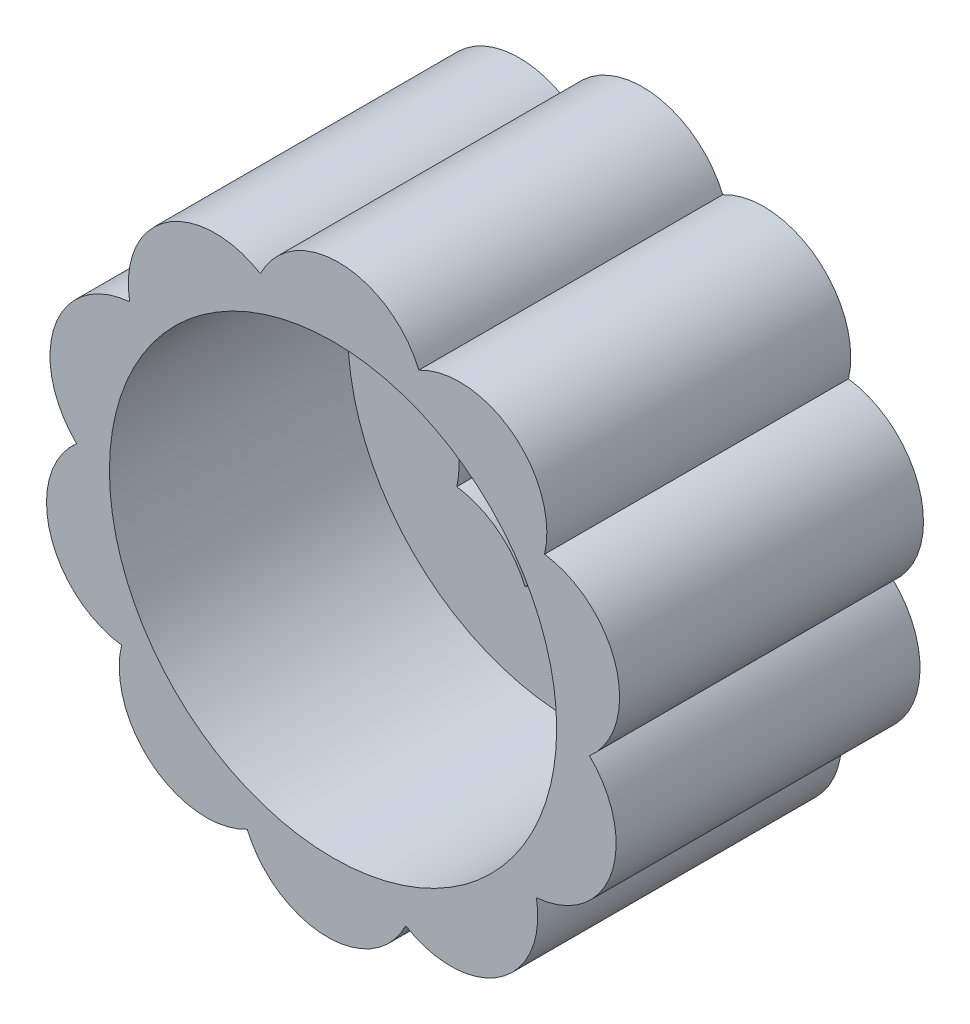
from build123d import *

# Parameters (mm, degrees)
EXTRUDE_1_DEPTH = 87
SKETCH_2_W      = 30.108921009
SKETCH_2_H      = 80.924328046


with BuildPart() as part:
    # 草图1 → 凸台-拉伸1 (new body)
    with BuildSketch(Plane.XY):
        with BuildLine():
            ThreePointArc((-20.80288439, 70.428851171), (-47.791271034, 69.651792293), (-58.226927057, 44.750508842))
            ThreePointArc((-58.226927057, 44.750508842), (-79.604246754, 28.258479352), (-73.41026265, 1.978993149))
            ThreePointArc((-73.41026265, 1.978993149), (-81.011105864, -23.928612231), (-60.553373033, -41.548430663))
            ThreePointArc((-60.553373033, -41.548430663), (-51.474476, -66.975787246), (-24.567153051, -69.205766141))
            ThreePointArc((-24.567153051, -69.205766141), (-2.276345856, -84.440487955), (20.80288439, -70.428851171))
            ThreePointArc((20.80288439, -70.428851171), (47.791271034, -69.651792293), (58.226927057, -44.750508842))
            ThreePointArc((58.226927057, -44.750508842), (79.604246754, -28.258479352), (73.41026265, -1.978993149))
            ThreePointArc((73.41026265, -1.978993149), (81.011105864, 23.928612231), (60.553373033, 41.548430663))
            ThreePointArc((60.553373033, 41.548430663), (51.474476, 66.975787246), (24.567153051, 69.205766141))
            ThreePointArc((24.567153051, 69.205766141), (2.276345856, 84.440487955), (-20.80288439, 70.428851171))
        make_face()
        with BuildLine():
            ThreePointArc((-11.286570005, 38.211054977), (0.933445053, 34.625913967), (13.328867648, 37.547472247))
            ThreePointArc((13.328867648, 37.547472247), (21.107774488, 27.464287609), (32.853130891, 22.542031311))
            ThreePointArc((32.853130891, 22.542031311), (33.219651496, 9.812236861), (39.82861477, -1.073699411))
            ThreePointArc((39.82861477, -1.073699411), (32.642750726, -11.587754862), (31.590921532, -24.279313452))
            ThreePointArc((31.590921532, -24.279313452), (19.597428665, -28.561618081), (11.286570005, -38.211054977))
            ThreePointArc((11.286570005, -38.211054977), (-0.933445053, -34.625913967), (-13.328867648, -37.547472247))
            ThreePointArc((-13.328867648, -37.547472247), (-21.107774488, -27.464287609), (-32.853130891, -22.542031311))
            ThreePointArc((-32.853130891, -22.542031311), (-33.219651496, -9.812236861), (-39.82861477, 1.073699411))
            ThreePointArc((-39.82861477, 1.073699411), (-32.642750726, 11.587754862), (-31.590921532, 24.279313452))
            ThreePointArc((-31.590921532, 24.279313452), (-19.597428665, 28.561618081), (-11.286570005, 38.211054977))
        make_face(mode=Mode.SUBTRACT)
    extrude(amount=EXTRUDE_1_DEPTH)

    # 草图2 → 切除-旋转1 (revolve, cut)
    with BuildSketch(Plane(origin=(0, 0, 0), x_dir=(1, 0, 0), z_dir=(0, 1, 0))):
        with Locations((-48.966613642, -59.188332526)):
            Rectangle(SKETCH_2_W, SKETCH_2_H)
    revolve(axis=Axis((0, 0, 0), (0, 0, 1)), mode=Mode.SUBTRACT)


solid = part.part
